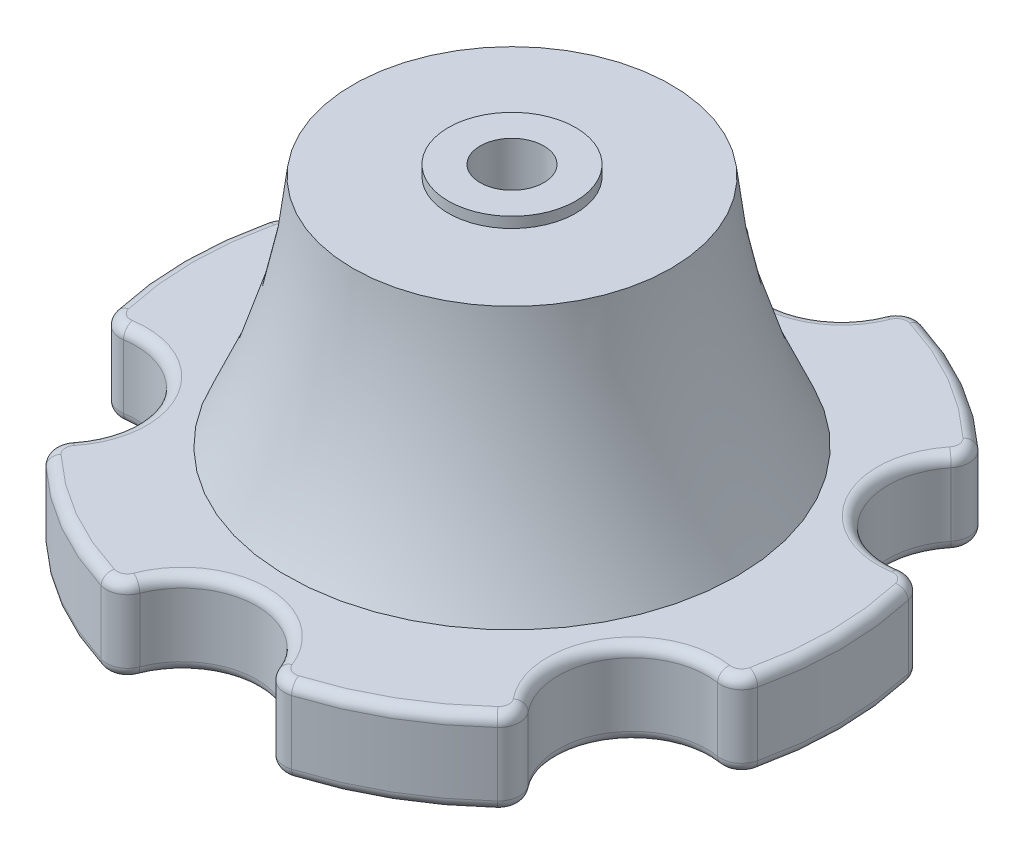
from build123d import *

# Parameters (mm, degrees)
EXTRUDE_1_DEPTH     = 15
SKETCH_3_R          = 1.5
CUT_EXTRUDE_1_DEPTH = 15
SKETCH_4_R          = 3
CUT_EXTRUDE_2_DEPTH = 6
FILLET_1_R          = 1
FILLET_2_R          = 0.5
SKETCH_5_R          = 3
SKETCH_5_R_2        = 1.5
EXTRUDE_2_DEPTH     = 0.5


with BuildPart() as part:
    # Эскиз1 → Бобышка-Вытянуть1 (new body)
    with BuildSketch(Plane(origin=(0, 0, 0), x_dir=(1, 0, 0), z_dir=(0, 1, 0))):
        with BuildLine():
            ThreePointArc((-3.477707616, 15.135602061), (0, 12.03), (3.477707616, 15.135602061))
            ThreePointArc((3.477707616, 15.135602061), (7.765, 13.449374521), (11.368962078, 10.579584173))
            ThreePointArc((11.368962078, 10.579584173), (10.418285608, 6.015), (14.846669694, 4.556017888))
            ThreePointArc((14.846669694, 4.556017888), (15.53, 0), (14.846669694, -4.556017888))
            ThreePointArc((14.846669694, -4.556017888), (10.418285608, -6.015), (11.368962078, -10.579584173))
            ThreePointArc((11.368962078, -10.579584173), (7.765, -13.449374521), (3.477707616, -15.135602061))
            ThreePointArc((3.477707616, -15.135602061), (0, -12.03), (-3.477707616, -15.135602061))
            ThreePointArc((-3.477707616, -15.135602061), (-7.765, -13.449374521), (-11.368962078, -10.579584173))
            ThreePointArc((-11.368962078, -10.579584173), (-10.418285608, -6.015), (-14.846669694, -4.556017888))
            ThreePointArc((-14.846669694, -4.556017888), (-15.53, 0), (-14.846669694, 4.556017888))
            ThreePointArc((-14.846669694, 4.556017888), (-10.418285608, 6.015), (-11.368962078, 10.579584173))
            ThreePointArc((-11.368962078, 10.579584173), (-7.765, 13.449374521), (-3.477707616, 15.135602061))
        make_face()
    extrude(amount=EXTRUDE_1_DEPTH)

    # Эскиз2 → Вырез-Повернуть1 (revolve, cut)
    with BuildSketch(Plane.XY, mode=Mode.PRIVATE) as cut_revolve_1_sk:
        with BuildLine():
            Line((-15.6, 31), (-15.6, 4))
            Line((-15.6, 4), (-10.6, 4))
            ThreePointArc((-10.6, 4), (-7.390856649, 17.5), (-10.6, 31))
            Line((-10.6, 31), (-15.6, 31))
        make_face()
    revolve(cut_revolve_1_sk.sketch.rotate(Axis((0, -1000, 0), (0, 1, 0)), 180), axis=Axis((0, -1000, 0), (0, 1, 0)), mode=Mode.SUBTRACT)

    # Эскиз3 → Вырез-Вытянуть1 (cut)
    with BuildSketch(Plane.XZ):
        with Locations(Location((0, 0, 0), (0, 0, 270))):
            Circle(SKETCH_3_R)
    extrude(amount=-CUT_EXTRUDE_1_DEPTH, mode=Mode.SUBTRACT)

    # Эскиз4 → Вырез-Вытянуть2 (cut)
    with BuildSketch(Plane.XZ):
        with Locations(Location((0, 0, 0), (0, 0, 270))):
            Circle(SKETCH_4_R)
    extrude(amount=-CUT_EXTRUDE_2_DEPTH, mode=Mode.SUBTRACT)

    # Скругление1
    fillet_1_edges = [part.edges().sort_by_distance(p)[0] for p in [
        (-3.477707616, 2, -15.135602061),
        (3.477707616, 2, -15.135602061),
        (11.368962078, 2, -10.579584173),
        (14.846669694, 2, -4.556017888),
        (14.846669694, 2, 4.556017888),
        (11.368962078, 2, 10.579584173),
        (3.477707616, 2, 15.135602061),
        (-3.477707616, 2, 15.135602061),
        (-11.368962078, 2, 10.579584173),
        (-14.846669694, 2, 4.556017888),
        (-14.846669694, 2, -4.556017888),
        (-11.368962078, 2, -10.579584173),
    ]]
    fillet(fillet_1_edges, radius=FILLET_1_R)

    # Скругление2
    fillet_2_edges = [part.edges().sort_by_distance(p)[0] for p in [
        (10.945056155, 4, -10.659830131),
        (14.704211771, 4, -4.148781611),
        (14.704211771, 4, 4.148781611),
        (10.945056155, 4, 10.659830131),
        (3.759155616, 4, 14.808611742),
        (-3.759155616, 4, 14.808611742),
        (-10.945056155, 4, 10.659830131),
        (-7.765, 4, 13.449374521),
        (-7.765, 0, 13.449374521),
        (-7.765, 0, -13.449374521),
        (0, 0, -12.03),
        (7.765, 0, -13.449374521),
        (10.418285608, 0, -6.015),
        (15.53, 0, 0),
        (10.418285608, 0, 6.015),
        (7.765, 0, 13.449374521),
        (0, 0, 12.03),
        (-10.418285608, 0, 6.015),
        (-15.53, 0, 0),
        (-10.418285608, 0, -6.015),
        (-14.704211771, 0, 4.148781611),
        (-14.704211771, 0, -4.148781611),
        (-10.945056155, 0, -10.659830131),
        (3.759155616, 0, -14.808611742),
        (-3.759155616, 0, -14.808611742),
        (10.945056155, 0, -10.659830131),
        (14.704211771, 0, -4.148781611),
        (14.704211771, 0, 4.148781611),
        (10.945056155, 0, 10.659830131),
        (3.759155616, 0, 14.808611742),
        (-3.759155616, 0, 14.808611742),
        (-10.945056155, 0, 10.659830131),
        (-10.418285608, 4, 6.015),
        (-7.765, 4, -13.449374521),
        (-10.418285608, 4, -6.015),
        (-15.53, 4, 0),
        (0, 4, 12.03),
        (7.765, 4, 13.449374521),
        (10.418285608, 4, 6.015),
        (15.53, 4, 0),
        (10.418285608, 4, -6.015),
        (7.765, 4, -13.449374521),
        (0, 4, -12.03),
        (-14.704211771, 4, 4.148781611),
        (-14.704211771, 4, -4.148781611),
        (-10.945056155, 4, -10.659830131),
        (3.759155616, 4, -14.808611742),
        (-3.759155616, 4, -14.808611742),
    ]]
    fillet(fillet_2_edges, radius=FILLET_2_R)

    # Эскиз5 → Бобышка-Вытянуть2 (add)
    with BuildSketch(Plane(origin=(0, 15, 0), x_dir=(1, 0, 0), z_dir=(0, 1, 0))):
        with Locations(Location((0, 0, 0), (0, 0, 90))):
            Circle(SKETCH_5_R)
        with Locations(Location((0, 0, 0), (0, 0, 90))):
            Circle(SKETCH_5_R_2, mode=Mode.SUBTRACT)
    extrude(amount=EXTRUDE_2_DEPTH)


solid = part.part
